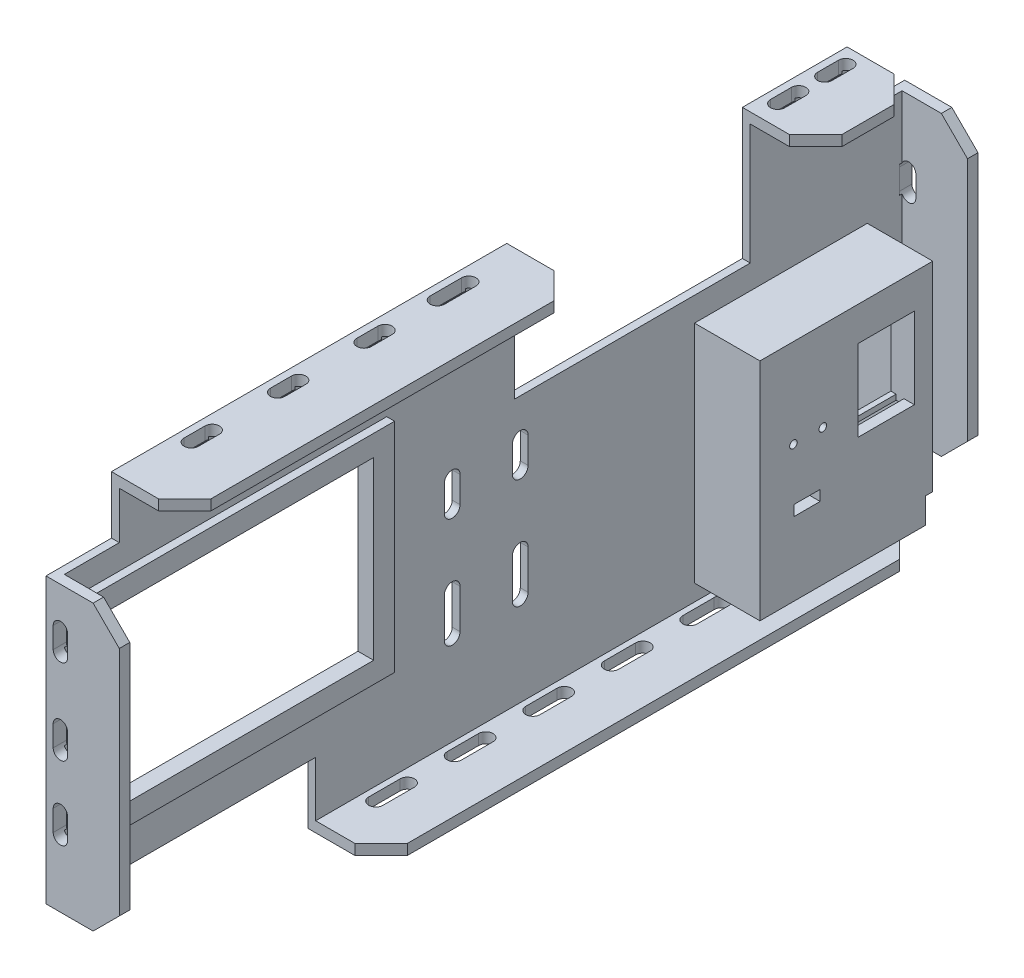
from build123d import *

# Parameters (mm, degrees)
SKETCH_1_W           = 80
SKETCH_1_H           = 97
SKETCH_1_W_2         = 60
SKETCH_1_H_2         = 77
EXTRUDE_1_DEPTH      = 6
SKETCH_2_W           = 60
SKETCH_2_H           = 10
EXTRUDE_2_DEPTH      = 25
SKETCH_3_W           = 60
SKETCH_3_H           = 77
EXTRUDE_3_DEPTH      = 4
SKETCH_4_W           = 21.5
SKETCH_4_H           = 31
CUT_EXTRUDE_1_DEPTH  = 4
SKETCH_5_W           = 25.5
SKETCH_5_H           = 35
SKETCH_5_W_2         = 21.5
SKETCH_5_H_2         = 31
EXTRUDE_4_DEPTH      = 5
SKETCH_6_W           = 3
SKETCH_6_H           = 21.5
CUT_EXTRUDE_2_DEPTH  = 37
SKETCH_7_W           = 18.2
SKETCH_7_H           = 30.1
CUT_EXTRUDE_3_DEPTH  = 1.5
SKETCH_8_R           = 1.45
CUT_EXTRUDE_5_DEPTH  = 4.5
FILLET_1_R           = 3
FILLET_2_R           = 3
SKETCH_9_R           = 2.75
CUT_EXTRUDE_6_DEPTH  = 10
SKETCH_10_W          = 60
SKETCH_10_H          = 5
CUT_EXTRUDE_7_DEPTH  = 20
SKETCH_11_W          = 60
SKETCH_11_H          = 10
EXTRUDE_5_DEPTH      = 5
SKETCH_12_R          = 2.7
CUT_EXTRUDE_8_DEPTH  = 5
SKETCH_13_W          = 21
SKETCH_13_H          = 3
CUT_EXTRUDE_9_DEPTH  = 80
SKETCH_14_W          = 174.976992902
SKETCH_14_H          = 186.642125763
CUT_EXTRUDE_11_DEPTH = 22
SKETCH_15_W          = 60
SKETCH_15_H          = 10
SKETCH_15_H_2        = 7
CUT_EXTRUDE_12_DEPTH = 22
SKETCH_19_W          = 328
SKETCH_19_H          = 155.5
SKETCH_19_W_2        = 320
SKETCH_19_H_2        = 147.5
EXTRUDE_6_DEPTH      = 28
SKETCH_20_W          = 66
SKETCH_20_H          = 86
SKETCH_20_W_2        = 60
SKETCH_20_H_2        = 80
EXTRUDE_7_DEPTH      = 28
SKETCH_21_W          = 328
SKETCH_21_H          = 155.5
SKETCH_21_W_2        = 66
SKETCH_21_H_2        = 86
EXTRUDE_8_DEPTH      = 3
CUT_EXTRUDE_13_DEPTH = 3
SKETCH_24_W          = 105.3
SKETCH_24_H          = 67.1
CUT_EXTRUDE_15_DEPTH = 3
SKETCH_26_W          = 121.3
SKETCH_26_H          = 83.1
SKETCH_26_W_2        = 105.3
SKETCH_26_H_2        = 67.1
EXTRUDE_11_DEPTH     = 3
SKETCH_27_W          = 100
SKETCH_27_H          = 25
CUT_EXTRUDE_16_DEPTH = 36
SKETCH_28_W          = 20
SKETCH_28_H          = 20
CUT_EXTRUDE_17_DEPTH = 36
SKETCH_29_W          = 22
SKETCH_29_H          = 22
SKETCH_29_W_2        = 25
CUT_EXTRUDE_18_DEPTH = 36
SKETCH_31_W          = 90
SKETCH_31_H          = 50
CUT_EXTRUDE_19_DEPTH = 36
SKETCH_32_W          = 10
SKETCH_32_H          = 4
CUT_EXTRUDE_20_DEPTH = 36
CUT_EXTRUDE_21_DEPTH = 5
CUT_EXTRUDE_22_DEPTH = 5
CUT_EXTRUDE_23_DEPTH = 5
CUT_EXTRUDE_24_DEPTH = 5
CHAMFER_1_SIZE       = 10


with BuildPart() as part:
    # 草图1 → 凸台-拉伸1 (new body)
    with BuildSketch(Plane(origin=(0, 0, 0), x_dir=(0, 0, -1), z_dir=(1, 0, 0))):
        with Locations((40, 48.5)):
            Rectangle(SKETCH_1_W, SKETCH_1_H)
        with Locations((40, 48.5)):
            Rectangle(SKETCH_1_W_2, SKETCH_1_H_2, mode=Mode.SUBTRACT)
    extrude(amount=EXTRUDE_1_DEPTH)

    # 草图2 → 凸台-拉伸2 (add)
    with BuildSketch(Plane(origin=(6, 0, 0), x_dir=(0, 0, -1), z_dir=(1, 0, 0))):
        with Locations((40, 92)):
            Rectangle(SKETCH_2_W, SKETCH_2_H)
        with Locations((40, 5)):
            Rectangle(SKETCH_2_W, SKETCH_2_H)
    extrude(amount=EXTRUDE_2_DEPTH)

    # 草图3 → 凸台-拉伸3 (add)
    with BuildSketch(Plane(origin=(31, 0, 0), x_dir=(0, 0, -1), z_dir=(1, 0, 0))):
        with Locations((40, 48.5)):
            Rectangle(SKETCH_3_W, SKETCH_3_H)
    extrude(amount=-EXTRUDE_3_DEPTH)

    # 草图4 → 切除-拉伸1 (cut)
    with BuildSketch(Plane.ZY.offset(-27)):
        with Locations((-55.25, 61.5)):
            Rectangle(SKETCH_4_W, SKETCH_4_H)
    extrude(amount=-CUT_EXTRUDE_1_DEPTH, mode=Mode.SUBTRACT)

    # 草图5 → 凸台-拉伸4 (add)
    with BuildSketch(Plane.ZY.offset(-27)):
        with Locations((-55.25, 61.5)):
            Rectangle(SKETCH_5_W, SKETCH_5_H)
        with Locations((-55.25, 61.5)):
            Rectangle(SKETCH_5_W_2, SKETCH_5_H_2, mode=Mode.SUBTRACT)
    extrude(amount=EXTRUDE_4_DEPTH)

    # 草图6 → 切除-拉伸2 (cut)
    with BuildSketch(Plane.XZ.offset(-44)):
        with Locations((25.5, -55.25)):
            Rectangle(SKETCH_6_W, SKETCH_6_H)
    extrude(amount=-CUT_EXTRUDE_2_DEPTH, mode=Mode.SUBTRACT)

    # 草图7 → 切除-拉伸3 (cut)
    with BuildSketch(Plane.ZY.offset(-27)):
        with Locations((-25.4, 59.05)):
            Rectangle(SKETCH_7_W, SKETCH_7_H)
    extrude(amount=-CUT_EXTRUDE_3_DEPTH, mode=Mode.SUBTRACT)

    # 草图8 → 切除-拉伸5 (cut)
    with BuildSketch(Plane.ZY.offset(-28.5)):
        with Locations((-31, 56)):
            Circle(SKETCH_8_R)
        with Locations((-19.8, 56)):
            Circle(SKETCH_8_R)
    extrude(amount=-CUT_EXTRUDE_5_DEPTH, mode=Mode.SUBTRACT)

    # 圆角1
    fillet_1_edges = [part.edges().sort_by_distance(p)[0] for p in [
        (0, 0, -40),
    ]]
    fillet(fillet_1_edges, radius=FILLET_1_R)

    # 圆角2
    fillet_2_edges = [part.edges().sort_by_distance(p)[0] for p in [
        (0, 97, -40),
    ]]
    fillet(fillet_2_edges, radius=FILLET_2_R)

    # 草图9 → 切除-拉伸6 (cut)
    with BuildSketch(Plane(origin=(0, 97, 0), x_dir=(1, 0, 0), z_dir=(0, 1, 0))):
        with Locations(Location((6.2, 54, 0), (0, 0, 270))):
            Circle(SKETCH_9_R)
        with Locations(Location((6.2, 46, 0), (0, 0, 270))):
            Circle(SKETCH_9_R)
        with Locations(Location((6.2, 36, 0), (0, 0, 270))):
            Circle(SKETCH_9_R)
        with Locations(Location((6.2, 28, 0), (0, 0, 270))):
            Circle(SKETCH_9_R)
    extrude(amount=-CUT_EXTRUDE_6_DEPTH, mode=Mode.SUBTRACT)

    # 草图10 → 切除-拉伸7 (cut)
    with BuildSketch(Plane.ZY):
        with Locations((-40, 89.5)):
            Rectangle(SKETCH_10_W, SKETCH_10_H)
    extrude(amount=-CUT_EXTRUDE_7_DEPTH, mode=Mode.SUBTRACT)

    # 草图11 → 凸台-拉伸5 (add)
    with BuildSketch(Plane.ZY):
        with Locations((-40, 15)):
            Rectangle(SKETCH_11_W, SKETCH_11_H)
    extrude(amount=-EXTRUDE_5_DEPTH)

    # 草图12 → 切除-拉伸8 (cut)
    with BuildSketch(Plane.ZY):
        with Locations((-61, 14)):
            Circle(SKETCH_12_R)
        with Locations((-46, 14)):
            Circle(SKETCH_12_R)
        with Locations((-30, 14)):
            Circle(SKETCH_12_R)
        with Locations((-15, 14)):
            Circle(SKETCH_12_R)
    extrude(amount=-CUT_EXTRUDE_8_DEPTH, mode=Mode.SUBTRACT)

    # 草图13 → 切除-拉伸9 (cut)
    with BuildSketch(Plane(origin=(0, 0, -70), x_dir=(-1, 0, 0), z_dir=(0, 0, -1))):
        with Locations((-16.5, 8.5)):
            Rectangle(SKETCH_13_W, SKETCH_13_H)
    extrude(amount=-CUT_EXTRUDE_9_DEPTH, mode=Mode.SUBTRACT)

    # 草图14 → 切除-拉伸11 (cut)
    with BuildSketch(Plane.ZY):
        with Locations((-33.745299693, 32.742932649)):
            Rectangle(SKETCH_14_W, SKETCH_14_H)
    extrude(amount=-CUT_EXTRUDE_11_DEPTH, mode=Mode.SUBTRACT)

    # 草图15 → 切除-拉伸12 (cut)
    with BuildSketch(Plane.ZY.offset(-22)):
        with Locations((-40, 92)):
            Rectangle(SKETCH_15_W, SKETCH_15_H)
        with Locations((-40, 3.5)):
            Rectangle(SKETCH_15_W, SKETCH_15_H_2)
    extrude(amount=-CUT_EXTRUDE_12_DEPTH, mode=Mode.SUBTRACT)

    # 草图20 → 凸台-拉伸7 (add)
    with BuildSketch(Plane(origin=(31, 0, 0), x_dir=(0, 0, -1), z_dir=(1, 0, 0))):
        with Locations((40, 47)):
            Rectangle(SKETCH_20_W, SKETCH_20_H)
        with Locations((40, 47)):
            Rectangle(SKETCH_20_W_2, SKETCH_20_H_2, mode=Mode.SUBTRACT)
    extrude(amount=-EXTRUDE_7_DEPTH)



with BuildPart() as body_2:
    # 草图19 → 凸台-拉伸6 (new body)
    with BuildSketch(Plane(origin=(31, 0, 0), x_dir=(0, 0, -1), z_dir=(1, 0, 0))):
        with Locations((-73.71179632, 71.480027444)):
            Rectangle(SKETCH_19_W, SKETCH_19_H)
        with Locations((-73.71179632, 71.480027444)):
            Rectangle(SKETCH_19_W_2, SKETCH_19_H_2, mode=Mode.SUBTRACT)
    extrude(amount=-EXTRUDE_6_DEPTH)


with BuildPart() as part_1:
    add(part.part)

    add(body_2.part)  # 凸台-拉伸8 merges body 2
    # 草图21 → 凸台-拉伸8 (add)
    with BuildSketch(Plane.ZY.offset(-3)):
        with Locations((73.71179632, 71.480027444)):
            Rectangle(SKETCH_21_W, SKETCH_21_H)
        with Locations((-40, 47)):
            Rectangle(SKETCH_21_W_2, SKETCH_21_H_2, mode=Mode.SUBTRACT)
    extrude(amount=-EXTRUDE_8_DEPTH)

    # 草图22 → 切除-拉伸13 (cut)
    with BuildSketch(Plane(origin=(6, 0, 0), x_dir=(0, 0, -1), z_dir=(1, 0, 0))):
        with BuildLine():
            Line((-82.559849638, 84.730027444), (-82.559849638, 74.730027444))
            ThreePointArc((-82.559849638, 74.730027444), (-85.559849638, 71.730027444), (-88.559849638, 74.730027444))
            Line((-88.559849638, 74.730027444), (-88.559849638, 84.730027444))
            ThreePointArc((-88.559849638, 84.730027444), (-85.559849638, 87.730027444), (-82.559849638, 84.730027444))
        make_face()
        with BuildLine():
            Line((-88.559849638, 32.730027444), (-88.559849638, 47.730027444))
            ThreePointArc((-88.559849638, 47.730027444), (-85.559849638, 50.730027444), (-82.559849638, 47.730027444))
            Line((-82.559849638, 47.730027444), (-82.559849638, 32.730027444))
            ThreePointArc((-82.559849638, 32.730027444), (-85.559849638, 29.730027444), (-88.559849638, 32.730027444))
        make_face()
        with BuildLine():
            Line((-62.559849638, 74.725778503), (-62.559849638, 84.725778503))
            ThreePointArc((-62.559849638, 84.725778503), (-59.559849638, 87.725778503), (-56.559849638, 84.725778503))
            Line((-56.559849638, 84.725778503), (-56.559849638, 74.725778503))
            ThreePointArc((-56.559849638, 74.725778503), (-59.559849638, 71.725778503), (-62.559849638, 74.725778503))
        make_face()
        with BuildLine():
            Line((-62.559849638, 32.730027444), (-62.559849638, 47.730027444))
            ThreePointArc((-62.559849638, 47.730027444), (-59.559849638, 50.730027444), (-56.559849638, 47.730027444))
            Line((-56.559849638, 47.730027444), (-56.559849638, 32.730027444))
            ThreePointArc((-56.559849638, 32.730027444), (-59.559849638, 29.730027444), (-62.559849638, 32.730027444))
        make_face()
    extrude(amount=-CUT_EXTRUDE_13_DEPTH, mode=Mode.SUBTRACT)

    # 草图24 → 切除-拉伸15 (cut)
    with BuildSketch(Plane(origin=(6, 0, 0), x_dir=(0, 0, -1), z_dir=(1, 0, 0))):
        with Locations((-171.209849638, 76.280027444)):
            Rectangle(SKETCH_24_W, SKETCH_24_H)
    extrude(amount=-CUT_EXTRUDE_15_DEPTH, mode=Mode.SUBTRACT)

    # 草图26 → 凸台-拉伸11 (add)
    with BuildSketch(Plane(origin=(6, 0, 0), x_dir=(0, 0, -1), z_dir=(1, 0, 0))):
        with Locations((-171.209849638, 76.280027444)):
            Rectangle(SKETCH_26_W, SKETCH_26_H)
        with Locations((-171.209849638, 76.280027444)):
            Rectangle(SKETCH_26_W_2, SKETCH_26_H_2, mode=Mode.SUBTRACT)
    extrude(amount=EXTRUDE_11_DEPTH)

    # 草图27 → 切除-拉伸16 (cut)
    with BuildSketch(Plane(origin=(31, 0, 0), x_dir=(0, 0, -1), z_dir=(1, 0, 0))):
        with Locations((-187.71179632, 6.230027444)):
            Rectangle(SKETCH_27_W, SKETCH_27_H)
    extrude(amount=-CUT_EXTRUDE_16_DEPTH, mode=Mode.SUBTRACT)

    # 草图28 → 切除-拉伸17 (cut)
    with BuildSketch(Plane(origin=(31, 0, 0), x_dir=(0, 0, -1), z_dir=(1, 0, 0))):
        with Locations((80.28820368, 3.730027444)):
            Rectangle(SKETCH_28_W, SKETCH_28_H)
    extrude(amount=-CUT_EXTRUDE_17_DEPTH, mode=Mode.SUBTRACT)

    # 草图29 → 切除-拉伸18 (cut)
    with BuildSketch(Plane(origin=(31, 0, 0), x_dir=(0, 0, -1), z_dir=(1, 0, 0))):
        with Locations((79.28820368, 138.230027444)):
            Rectangle(SKETCH_29_W, SKETCH_29_H)
        with Locations((-225.21179632, 138.230027444)):
            Rectangle(SKETCH_29_W_2, SKETCH_29_H)
    extrude(amount=-CUT_EXTRUDE_18_DEPTH, mode=Mode.SUBTRACT)

    # 草图31 → 切除-拉伸19 (cut)
    with BuildSketch(Plane(origin=(31, 0, 0), x_dir=(0, 0, -1), z_dir=(1, 0, 0))):
        with Locations((-16.71179632, 124.230027444)):
            Rectangle(SKETCH_31_W, SKETCH_31_H)
    extrude(amount=-CUT_EXTRUDE_19_DEPTH, mode=Mode.SUBTRACT)

    # 草图32 → 切除-拉伸20 (cut)
    with BuildSketch(Plane.ZY.offset(-27)):
        with Locations((-25, 34)):
            Rectangle(SKETCH_32_W, SKETCH_32_H)
    extrude(amount=-CUT_EXTRUDE_20_DEPTH, mode=Mode.SUBTRACT)

    # 草图33 → 切除-拉伸21 (cut)
    with BuildSketch(Plane(origin=(0, 149.230027444, 0), x_dir=(1, 0, 0), z_dir=(0, 1, 0))):
        with BuildLine():
            Line((11.25, 62.28820368), (11.25, 54.28820368))
            ThreePointArc((11.25, 54.28820368), (8.5, 51.53820368), (5.75, 54.28820368))
            Line((5.75, 54.28820368), (5.75, 62.28820368))
            ThreePointArc((5.75, 62.28820368), (8.5, 65.03820368), (11.25, 62.28820368))
        make_face()
        with BuildLine():
            Line((11.25, -81.71179632), (11.25, -93.71179632))
            ThreePointArc((11.25, -93.71179632), (8.5, -96.46179632), (5.75, -93.71179632))
            Line((5.75, -93.71179632), (5.75, -81.71179632))
            ThreePointArc((5.75, -81.71179632), (8.5, -78.96179632), (11.25, -81.71179632))
        make_face()
        with BuildLine():
            Line((11.25, -113.71179632), (11.25, -121.71179632))
            ThreePointArc((11.25, -121.71179632), (8.5, -124.46179632), (5.75, -121.71179632))
            Line((5.75, -121.71179632), (5.75, -113.71179632))
            ThreePointArc((5.75, -113.71179632), (8.5, -110.96179632), (11.25, -113.71179632))
        make_face()
        with BuildLine():
            Line((11.25, -146.71179632), (11.25, -154.71179632))
            ThreePointArc((11.25, -154.71179632), (8.5, -157.46179632), (5.75, -154.71179632))
            Line((5.75, -154.71179632), (5.75, -146.71179632))
            ThreePointArc((5.75, -146.71179632), (8.5, -143.96179632), (11.25, -146.71179632))
        make_face()
        with BuildLine():
            Line((11.25, -179.71179632), (11.25, -187.71179632))
            ThreePointArc((11.25, -187.71179632), (8.5, -190.46179632), (5.75, -187.71179632))
            Line((5.75, -187.71179632), (5.75, -179.71179632))
            ThreePointArc((5.75, -179.71179632), (8.5, -176.96179632), (11.25, -179.71179632))
        make_face()
        with BuildLine():
            Line((11.25, 44.28820368), (11.25, 36.28820368))
            ThreePointArc((11.25, 36.28820368), (8.5, 33.53820368), (5.75, 36.28820368))
            Line((5.75, 36.28820368), (5.75, 44.28820368))
            ThreePointArc((5.75, 44.28820368), (8.5, 47.03820368), (11.25, 44.28820368))
        make_face()
    extrude(amount=-CUT_EXTRUDE_21_DEPTH, mode=Mode.SUBTRACT)

    # 草图34 → 切除-拉伸22 (cut)
    with BuildSketch(Plane(origin=(0, 0, -90.28820368), x_dir=(-1, 0, 0), z_dir=(0, 0, -1))):
        with BuildLine():
            Line((-5.75, 102.230027444), (-5.75, 94.230027444))
            ThreePointArc((-5.75, 94.230027444), (-8.5, 91.480027444), (-11.25, 94.230027444))
            Line((-11.25, 94.230027444), (-11.25, 102.230027444))
            ThreePointArc((-11.25, 102.230027444), (-8.5, 104.980027444), (-5.75, 102.230027444))
        make_face()
        with BuildLine():
            Line((-5.75, 64.730027444), (-5.75, 56.730027444))
            ThreePointArc((-5.75, 56.730027444), (-8.5, 53.980027444), (-11.25, 56.730027444))
            Line((-11.25, 56.730027444), (-11.25, 64.730027444))
            ThreePointArc((-11.25, 64.730027444), (-8.5, 67.480027444), (-5.75, 64.730027444))
        make_face()
        with BuildLine():
            Line((-5.75, 31.730027444), (-5.75, 23.730027444))
            ThreePointArc((-5.75, 23.730027444), (-8.5, 20.980027444), (-11.25, 23.730027444))
            Line((-11.25, 23.730027444), (-11.25, 31.730027444))
            ThreePointArc((-11.25, 31.730027444), (-8.5, 34.480027444), (-5.75, 31.730027444))
        make_face()
    extrude(amount=-CUT_EXTRUDE_22_DEPTH, mode=Mode.SUBTRACT)

    # 草图35 → 切除-拉伸23 (cut)
    with BuildSketch(Plane.XY.offset(237.71179632)):
        with BuildLine():
            Line((11.25, 112.230027444), (11.25, 104.230027444))
            ThreePointArc((11.25, 104.230027444), (8.5, 101.480027444), (5.75, 104.230027444))
            Line((5.75, 104.230027444), (5.75, 112.230027444))
            ThreePointArc((5.75, 112.230027444), (8.5, 114.980027444), (11.25, 112.230027444))
        make_face()
        with BuildLine():
            Line((11.25, 79.730027444), (11.25, 71.730027444))
            ThreePointArc((11.25, 71.730027444), (8.5, 68.980027444), (5.75, 71.730027444))
            Line((5.75, 71.730027444), (5.75, 79.730027444))
            ThreePointArc((5.75, 79.730027444), (8.5, 82.480027444), (11.25, 79.730027444))
        make_face()
        with BuildLine():
            Line((11.25, 51.730027444), (11.25, 43.730027444))
            ThreePointArc((11.25, 43.730027444), (8.5, 40.980027444), (5.75, 43.730027444))
            Line((5.75, 43.730027444), (5.75, 51.730027444))
            ThreePointArc((5.75, 51.730027444), (8.5, 54.480027444), (11.25, 51.730027444))
        make_face()
    extrude(amount=-CUT_EXTRUDE_23_DEPTH, mode=Mode.SUBTRACT)

    # 草图36 → 切除-拉伸24 (cut)
    with BuildSketch(Plane.XZ.offset(6.269972556)):
        with BuildLine():
            Line((13.75, 119.71179632), (13.75, 107.71179632))
            ThreePointArc((13.75, 107.71179632), (11, 104.96179632), (8.25, 107.71179632))
            Line((8.25, 107.71179632), (8.25, 119.71179632))
            ThreePointArc((8.25, 119.71179632), (11, 122.46179632), (13.75, 119.71179632))
        make_face()
        with BuildLine():
            Line((13.75, 89.71179632), (13.75, 77.71179632))
            ThreePointArc((13.75, 77.71179632), (11, 74.96179632), (8.25, 77.71179632))
            Line((8.25, 77.71179632), (8.25, 89.71179632))
            ThreePointArc((8.25, 89.71179632), (11, 92.46179632), (13.75, 89.71179632))
        make_face()
        with BuildLine():
            Line((13.75, 59.71179632), (13.75, 47.71179632))
            ThreePointArc((13.75, 47.71179632), (11, 44.96179632), (8.25, 47.71179632))
            Line((8.25, 47.71179632), (8.25, 59.71179632))
            ThreePointArc((8.25, 59.71179632), (11, 62.46179632), (13.75, 59.71179632))
        make_face()
        with BuildLine():
            Line((13.75, 29.71179632), (13.75, 17.71179632))
            ThreePointArc((13.75, 17.71179632), (11, 14.96179632), (8.25, 17.71179632))
            Line((8.25, 17.71179632), (8.25, 29.71179632))
            ThreePointArc((8.25, 29.71179632), (11, 32.46179632), (13.75, 29.71179632))
        make_face()
        with BuildLine():
            Line((13.75, -0.28820368), (13.75, -12.28820368))
            ThreePointArc((13.75, -12.28820368), (11, -15.03820368), (8.25, -12.28820368))
            Line((8.25, -12.28820368), (8.25, -0.28820368))
            ThreePointArc((8.25, -0.28820368), (11, 2.46179632), (13.75, -0.28820368))
        make_face()
        with BuildLine():
            Line((13.75, -30.28820368), (13.75, -42.28820368))
            ThreePointArc((13.75, -42.28820368), (11, -45.03820368), (8.25, -42.28820368))
            Line((8.25, -42.28820368), (8.25, -30.28820368))
            ThreePointArc((8.25, -30.28820368), (11, -27.53820368), (13.75, -30.28820368))
        make_face()
    extrude(amount=-CUT_EXTRUDE_24_DEPTH, mode=Mode.SUBTRACT)

    # 倒角1
    chamfer_1_edges = [part_1.edges().sort_by_distance(p)[0] for p in [
        (31, 18.730027444, 235.71179632),
        (31, -4.269972556, 137.71179632),
        (31, 13.730027444, -88.28820368),
        (31, -4.269972556, -70.28820368),
        (31, 147.230027444, 212.71179632),
        (31, 127.230027444, -88.28820368),
        (31, 147.230027444, -68.28820368),
        (31, 127.230027444, 235.71179632),
        (31, 147.230027444, -28.28820368),
        (31, 147.230027444, 61.71179632),
    ]]
    chamfer(chamfer_1_edges, length=CHAMFER_1_SIZE)


solid = part_1.part
